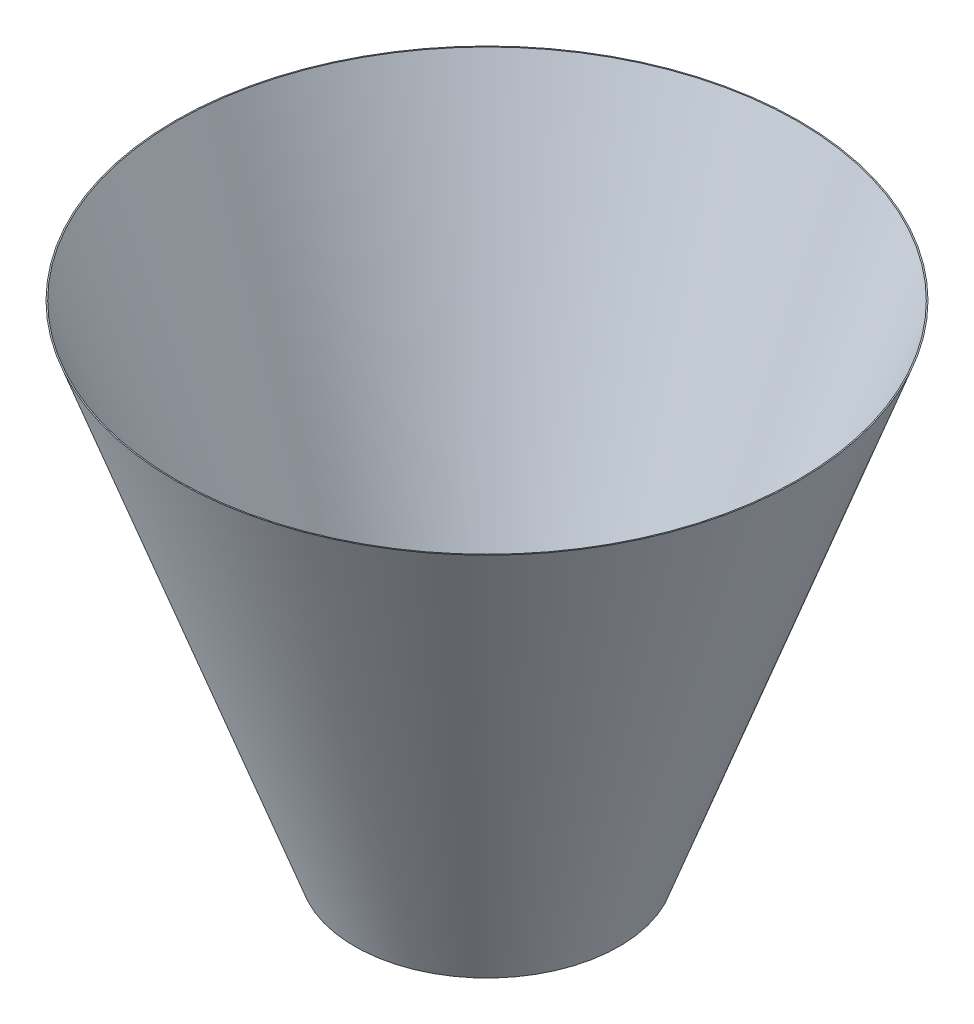
from build123d import *


with BuildPart() as part:
    # Sketch1 → Revolve1 (revolve)
    with BuildSketch(Plane.XY, mode=Mode.PRIVATE) as revolve1_sk:
        Polygon((375.3656323, 0), (889, 1411.198827112), (892.378764428, 1411.198827112), (378.744396728, 0), align=None)
    revolve(revolve1_sk.sketch.rotate(Axis((0, 0, 0), (0, 1, 0)), 90), axis=Axis((0, 0, 0), (0, 1, 0)))


solid = part.part
